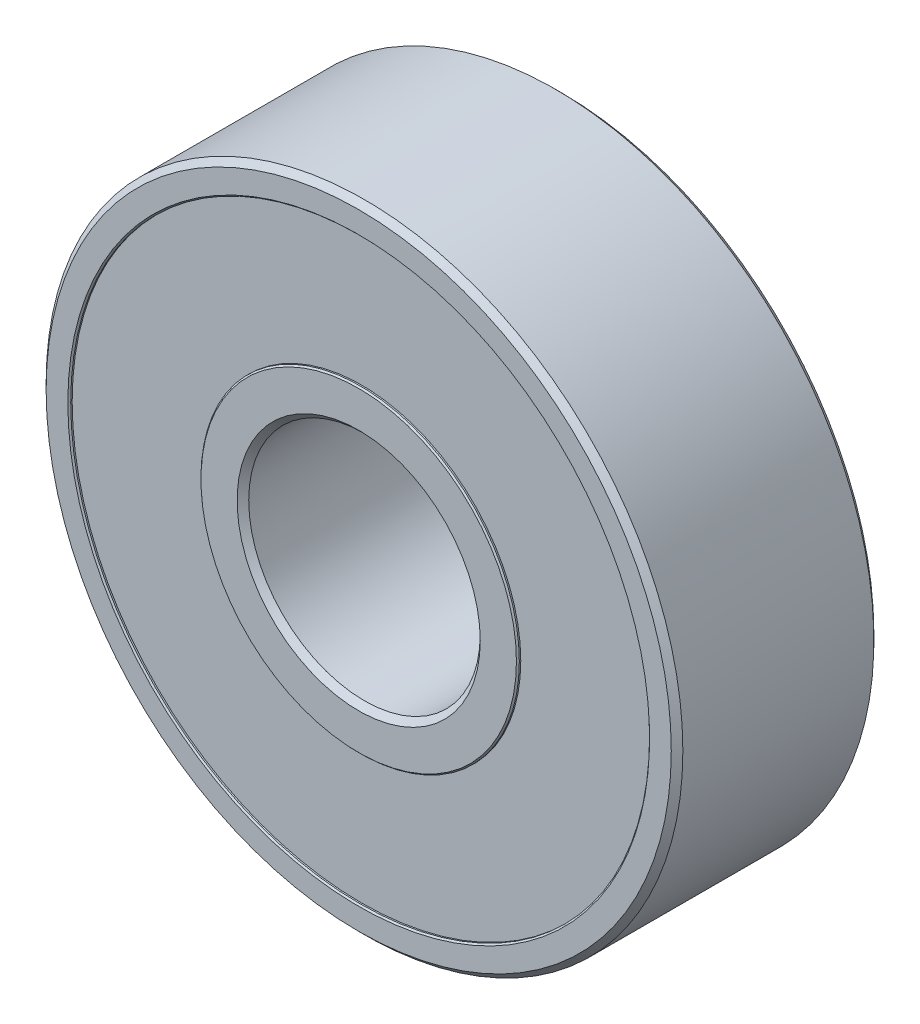
from build123d import *

# Parameters (mm, degrees)
SKETCH1_W                = 11
SKETCH1_H                = 7
SKETCH2_R                = 10.05
CUT_EXTRUDE1_DEPTH       = 0.05
CUT_EXTRUDE1_DRAFT       = -45
SKETCH3_R                = 10
CUT_EXTRUDE2_DEPTH       = 0.05
SKETCH4_R                = 5.5
BOSS_EXTRUDE1_DEPTH      = 0.05
SKETCH5_R                = 5.5
BOSS_EXTRUDE2_DEPTH      = 0.05
BOSS_EXTRUDE2_TAPER      = 45
SKETCH6_R                = 10.05
CUT_EXTRUDE3_DEPTH       = 0.05
CUT_EXTRUDE3_DRAFT       = -45
CUT_EXTRUDE4_START       = -0.05
SKETCH7_R                = 10
CUT_EXTRUDE4_DEPTH       = 0.05
F_8_0_8_DIAMETER_HOLE1_D = 8
CHAMFER1_SIZE            = 0.2


with BuildPart() as part:
    # Sketch1 → Revolve1 (revolve)
    with BuildSketch(Plane.XZ, mode=Mode.PRIVATE) as revolve1_sk:
        with Locations((5.5, 3.5)):
            Rectangle(SKETCH1_W, SKETCH1_H)
    revolve(revolve1_sk.sketch.rotate(Axis((0, 0, 7), (0, 0, -1)), 180), axis=Axis((0, 0, 7), (0, 0, -1)))


with BuildPart() as cut_extrude1_tool:
    # Sketch2 → Cut-Extrude1 (with draft: the straight prism first)
    with BuildSketch(Plane(origin=(0, 0, 0), x_dir=(-1, 0, 0), z_dir=(0, 0, -1))):
        Circle(SKETCH2_R)
    extrude(amount=-CUT_EXTRUDE1_DEPTH)
    # Cut-Extrude1: the draft: its side faces are tilted about the plane it starts from
    cut_extrude1_sides = [cut_extrude1_tool.faces().sort_by_distance(p)[0] for p in [
        (10.05, 0, 0.025),
    ]]
    draft(cut_extrude1_sides, Plane(origin=(0, 0, 0), x_dir=(-1, 0, 0), z_dir=(0, 0, -1)), CUT_EXTRUDE1_DRAFT)


with BuildPart() as part_1:
    add(part.part)

    # Cut-Extrude1: cut by cut_extrude1_tool
    add(cut_extrude1_tool.part, mode=Mode.SUBTRACT)

    # Sketch3 → Cut-Extrude2 (cut)
    with BuildSketch(Plane(origin=(0, 0, 0.05), x_dir=(-1, 0, 0), z_dir=(0, 0, -1))):
        with Locations(Location((0, 0, 0), (0, 0, 180))):
            Circle(SKETCH3_R)
    extrude(amount=-CUT_EXTRUDE2_DEPTH, mode=Mode.SUBTRACT)

    # Sketch4 → Boss-Extrude1 (add)
    with BuildSketch(Plane(origin=(0, 0, 0.1), x_dir=(-1, 0, 0), z_dir=(0, 0, -1))):
        with Locations(Location((0, 0, 0), (0, 0, 180))):
            Circle(SKETCH4_R)
    extrude(amount=BOSS_EXTRUDE1_DEPTH)

    # Sketch5 → Boss-Extrude2 (add)
    with BuildSketch(Plane(origin=(0, 0, 0.05), x_dir=(-1, 0, 0), z_dir=(0, 0, -1))):
        with Locations(Location((0, 0, 0), (0, 0, 180))):
            Circle(SKETCH5_R)
    extrude(amount=BOSS_EXTRUDE2_DEPTH, taper=BOSS_EXTRUDE2_TAPER)


with BuildPart() as cut_extrude3_tool:
    # Sketch6 → Cut-Extrude3 (with draft: the straight prism first)
    with BuildSketch(Plane.XY.offset(7)):
        Circle(SKETCH6_R)
    extrude(amount=-CUT_EXTRUDE3_DEPTH)
    # Cut-Extrude3: the draft: its side faces are tilted about the plane it starts from
    cut_extrude3_sides = [cut_extrude3_tool.faces().sort_by_distance(p)[0] for p in [
        (-10.05, 0, 6.975),
    ]]
    draft(cut_extrude3_sides, Plane.XY.offset(7), CUT_EXTRUDE3_DRAFT)


with BuildPart() as part_2:
    add(part_1.part)

    # Cut-Extrude3: cut by cut_extrude3_tool
    add(cut_extrude3_tool.part, mode=Mode.SUBTRACT)

    # Sketch7 → Cut-Extrude4 (cut)
    with BuildSketch(Plane.XY.offset(6.95).offset(CUT_EXTRUDE4_START)):
        Circle(SKETCH7_R)
    extrude(amount=CUT_EXTRUDE4_DEPTH, mode=Mode.SUBTRACT)

    # Sketch8 → Revolve2 (revolve)
    with BuildSketch(Plane(origin=(0, 0, 0), x_dir=(1, 0, 0), z_dir=(0, 1, 0))):
        Polygon((5.5, -6.9), (0, -6.9), (0, -7), (5.45, -7), (5.5, -6.95), align=None)
    revolve(axis=Axis((0, 0, 6.9), (0, 0, 1)))

    # Ø8.0 (8) Diameter Hole1 (through all)
    with Locations(Plane.XY.offset(7)):
        with Locations((0, 0)):
            Hole(F_8_0_8_DIAMETER_HOLE1_D / 2)

    # Chamfer1
    chamfer1_edges = [part_2.edges().sort_by_distance(p)[0] for p in [
        (11, 0, 0),
        (4, 0, 7),
        (4, 0, 0),
        (11, 0, 7),
    ]]
    chamfer(chamfer1_edges, length=CHAMFER1_SIZE)


solid = part_2.part
